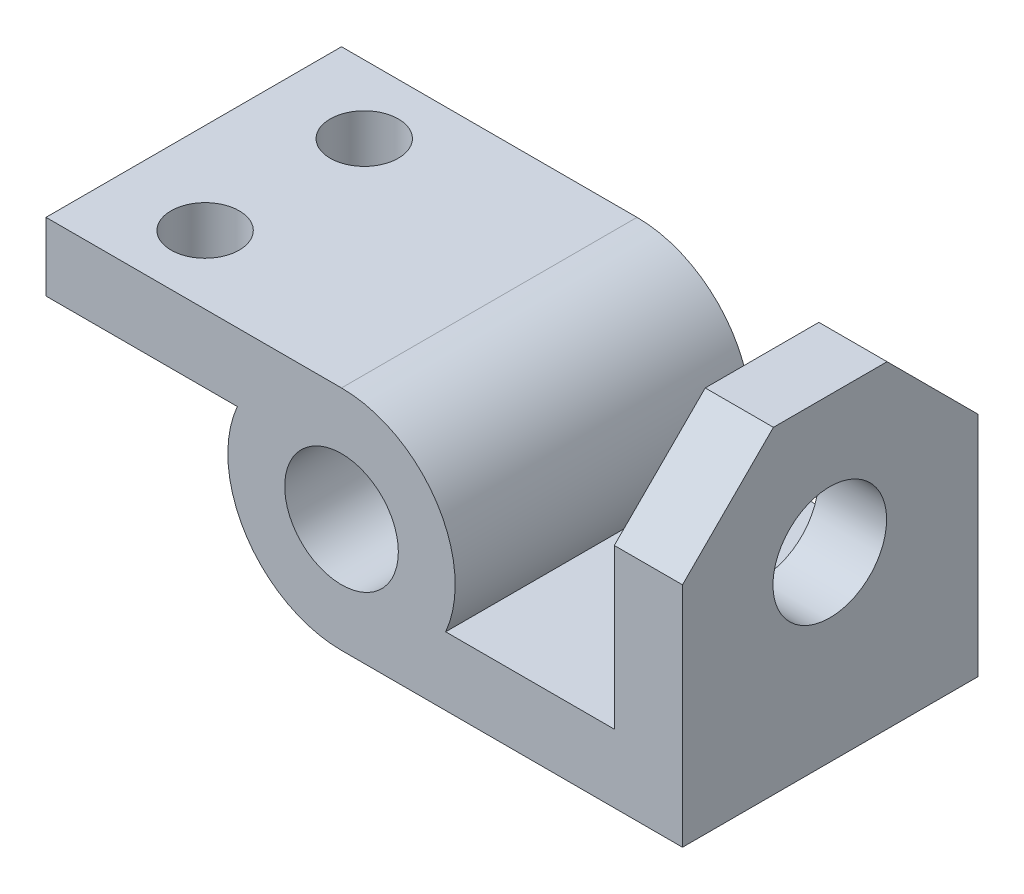
from build123d import *

# Parameters (mm, degrees)
SKETCH2_R           = 15.875
BOSS_EXTRUDE1_DEPTH = 82.55
SKETCH3_R           = 9.525
CUT_EXTRUDE1_DEPTH  = 19.05
CHAMFER1_SIZE       = 25.4
SKETCH4_R           = 15.875
CUT_EXTRUDE2_DEPTH  = 19.05


with BuildPart() as part:
    # Sketch2 → Boss-Extrude1 (new body)
    with BuildSketch(Plane.XY):
        with BuildLine():
            Line((0, -31.75), (95.25, -31.75))
            Line((95.25, -31.75), (95.25, 57.15))
            Line((95.25, 57.15), (76.2, 57.15))
            Line((76.2, 57.15), (76.2, -12.7))
            Line((76.2, -12.7), (29.099355663, -12.7))
            ThreePointArc((29.099355663, -12.7), (26.563955842, 17.390191201), (0, 31.75))
            Line((0, 31.75), (-82.55, 31.75))
            Line((-82.55, 31.75), (-82.55, 12.7))
            Line((-82.55, 12.7), (-29.099355663, 12.7))
            ThreePointArc((-29.099355663, 12.7), (-26.563955842, -17.390191201), (0, -31.75))
        make_face()
        Circle(SKETCH2_R, mode=Mode.SUBTRACT)
    extrude(amount=BOSS_EXTRUDE1_DEPTH)

    # Sketch3 → Cut-Extrude1 (cut)
    with BuildSketch(Plane(origin=(0, 31.75, 0), x_dir=(1, 0, 0), z_dir=(0, 1, 0))):
        with Locations(Location((-57.15, -63.5, 0), (0, 0, 180))):
            Circle(SKETCH3_R)
        with Locations(Location((-57.15, -19.05, 0), (0, 0, 180))):
            Circle(SKETCH3_R)
    extrude(amount=-CUT_EXTRUDE1_DEPTH, mode=Mode.SUBTRACT)

    # Chamfer1
    chamfer1_edges = [part.edges().sort_by_distance(p)[0] for p in [
        (85.725, 57.15, 0),
        (85.725, 57.15, 82.55),
    ]]
    chamfer(chamfer1_edges, length=CHAMFER1_SIZE)

    # Sketch4 → Cut-Extrude2 (cut)
    with BuildSketch(Plane(origin=(95.25, 0, 0), x_dir=(0, 0, -1), z_dir=(1, 0, 0))):
        with Locations((-41.402, 19.05)):
            Circle(SKETCH4_R)
    extrude(amount=-CUT_EXTRUDE2_DEPTH, mode=Mode.SUBTRACT)


solid = part.part
